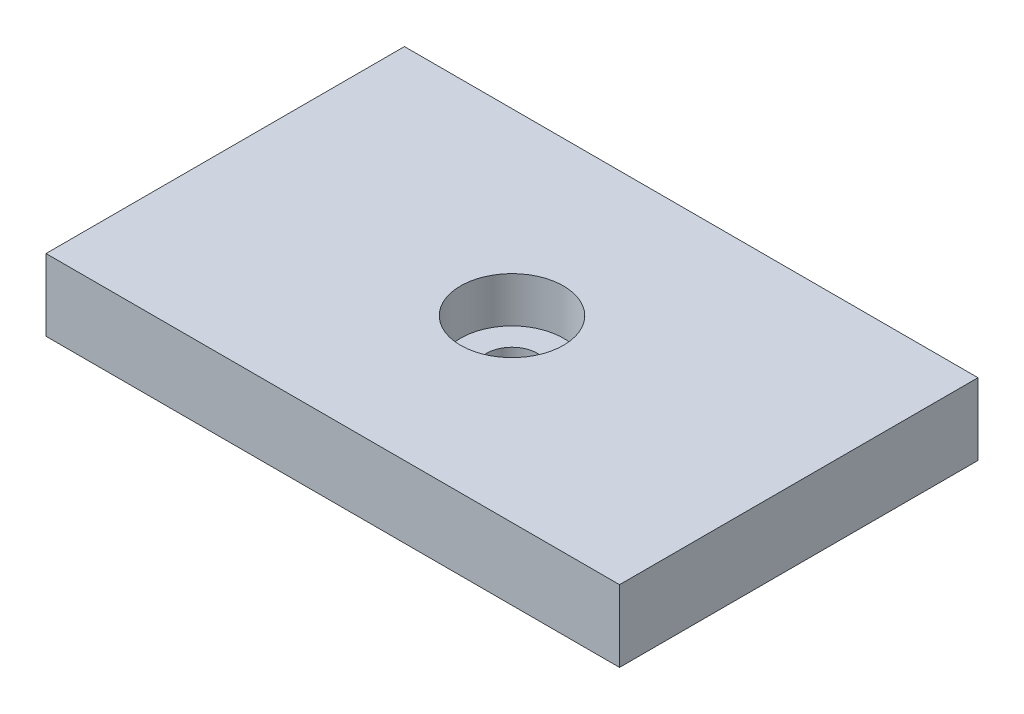
from build123d import *

# Parameters (mm, degrees)
SKETCH1_W           = 50.8
SKETCH1_H           = 31.75
SKETCH1_R           = 4.5593
BOSS_EXTRUDE1_DEPTH = 6.35
SKETCH1_3_R         = 4.5593
SKETCH1_3_R_2       = 2.2479
BOSS_EXTRUDE2_DEPTH = 2.3368


with BuildPart() as part:
    # Sketch1 → Boss-Extrude1 (new body)
    with BuildSketch(Plane(origin=(0, 0, 0), x_dir=(1, 0, 0), z_dir=(0, 1, 0))):
        Rectangle(SKETCH1_W, SKETCH1_H)
        Circle(SKETCH1_R, mode=Mode.SUBTRACT)
    extrude(amount=BOSS_EXTRUDE1_DEPTH)

    # Sketch1<3> → Boss-Extrude2 (add)
    with BuildSketch(Plane(origin=(0, 0, 0), x_dir=(1, 0, 0), z_dir=(0, 1, 0))):
        Circle(SKETCH1_3_R)
        Circle(SKETCH1_3_R_2, mode=Mode.SUBTRACT)
    extrude(amount=BOSS_EXTRUDE2_DEPTH)


solid = part.part
